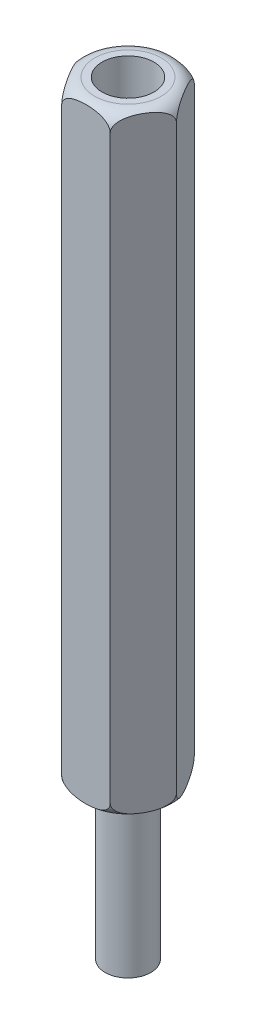
from build123d import *

# Parameters (mm, degrees)
BOSS_EXTRUDE1_DEPTH      = 40
M3_CLEARANCE_HOLE1_D     = 3.4
M3_CLEARANCE_HOLE1_DEPTH = 12
M3_CLEARANCE_HOLE1_TIP   = 1.021463052
SKETCH5_R                = 1.5
BOSS_EXTRUDE2_DEPTH      = 10


with BuildPart() as part:
    # Sketch1 → Boss-Extrude1 (new body)
    with BuildSketch(Plane(origin=(0, 0, 0), x_dir=(1, 0, 0), z_dir=(0, 1, 0))):
        Polygon((3.175426481, 0), (1.58771324, 2.75), (-1.58771324, 2.75), (-3.175426481, 0), (-1.58771324, -2.75), (1.58771324, -2.75), align=None)
    extrude(amount=BOSS_EXTRUDE1_DEPTH)

    # M3 Clearance Hole1
    with Locations(Plane(origin=(0, 40, 0), x_dir=(-1, 0, 0), z_dir=(0, 1, 0))):
        with Locations((0, 0)):
            Hole(M3_CLEARANCE_HOLE1_D / 2, depth=M3_CLEARANCE_HOLE1_DEPTH)
            with Locations((0, 0, -(M3_CLEARANCE_HOLE1_DEPTH + M3_CLEARANCE_HOLE1_TIP / 2))):  # 118° drill point
                Cone(0, M3_CLEARANCE_HOLE1_D / 2, M3_CLEARANCE_HOLE1_TIP, mode=Mode.SUBTRACT)

    # Sketch4 → Cut-Revolve1 (revolve, cut)
    with BuildSketch(Plane.XY, mode=Mode.PRIVATE) as cut_revolve1_sk:
        with BuildLine():
            Line((-2.175426481, 40), (-3.175426481, 40))
            Line((-3.175426481, 40), (-3.175426481, 39))
            ThreePointArc((-3.175426481, 39), (-2.882533262, 39.707106781), (-2.175426481, 40))
        make_face()
        with BuildLine():
            Line((-3.175426481, 1), (-3.175426481, 0))
            Line((-3.175426481, 0), (-2.175426481, 0))
            ThreePointArc((-2.175426481, 0), (-2.882533262, 0.292893219), (-3.175426481, 1))
        make_face()
    revolve(cut_revolve1_sk.sketch.rotate(Axis((0, 40, 0), (0, -1, 0)), 270), axis=Axis((0, 40, 0), (0, -1, 0)), mode=Mode.SUBTRACT)

    # Sketch5 → Boss-Extrude2 (add)
    with BuildSketch(Plane.XZ):
        with Locations(Location((0, 0, 0), (0, 0, 90))):
            Circle(SKETCH5_R)
    extrude(amount=BOSS_EXTRUDE2_DEPTH)


solid = part.part
